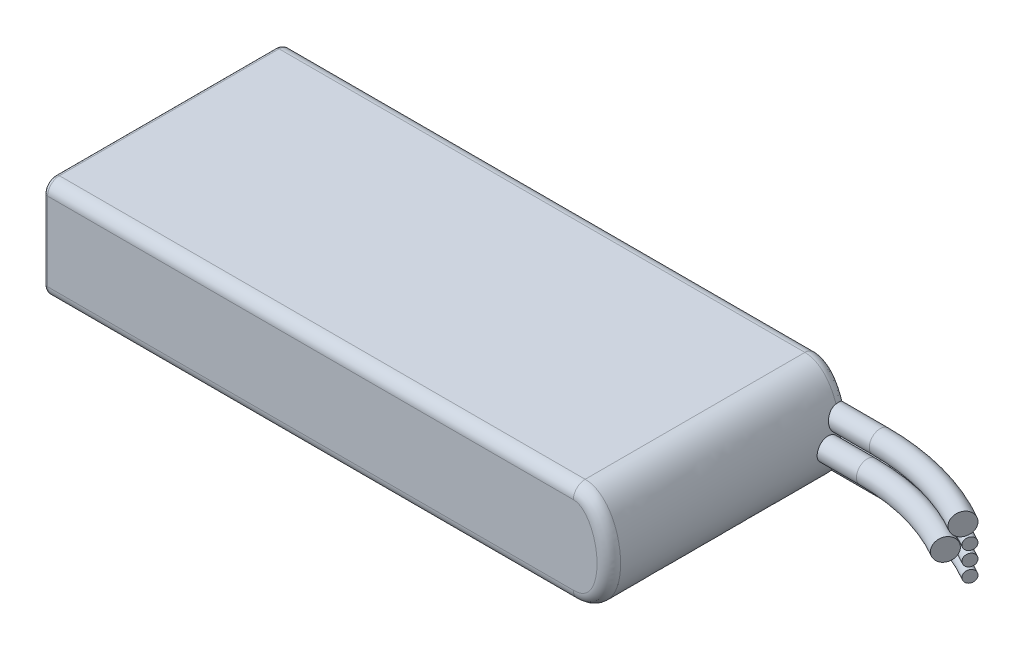
from build123d import *

# Parameters (mm, degrees)
BOSS_EXTRU_1_DEPTH = 15.5
CONG_1_R           = 1.5
CONG_2_R           = 0.5
BOSS_EXTRU_2_START = 2
ESQUISSE2_R        = 0.75
ESQUISSE2_R_2      = 1.4
BOSS_EXTRU_2_DEPTH = 75
ESQUISSE3_R        = 1.4
ESQUISSE3_R_2      = 0.75
R_VOLUTION1_ANGLE  = 30


with BuildPart() as part:
    # Esquisse1 → Boss.-Extru.1 (new, symmetric)
    with BuildSketch(Plane.XY):
        with BuildLine():
            Line((0, 0), (67.5, 0))
            add(Edge.make_bspline(
                [(67.5, 0), (72.819861551, 0), (74.180138449, -13), (67.5, -13)],
                knots=[0, 0, 0, 0, 1, 1, 1, 1], degree=3))
            Line((67.5, -13), (0, -13))
            Line((0, -13), (0, 0))
        make_face()
    extrude(amount=BOSS_EXTRU_1_DEPTH, both=True)

    # Congé1
    cong_1_edges = [part.edges().sort_by_distance(p)[0] for p in [
        (72.006450276, -6.641402384, 15.5),
        (33.75, 0, 15.5),
        (33.75, 0, -15.5),
        (72.006450276, -6.641402384, -15.5),
        (33.75, -13, -15.5),
        (33.75, -13, 15.5),
    ]]
    fillet(cong_1_edges, radius=CONG_1_R)

    # Congé2
    cong_2_edges = [part.edges().sort_by_distance(p)[0] for p in [
        (0, -13, 0),
        (0, -6.5, -15.5),
        (0, -6.5, 15.5),
        (0, 0, 0),
        (0, -0.439339828, 15.060660172),
        (0, -0.439339828, -15.060660172),
        (0, -12.560660172, 15.060660172),
        (0, -12.560660172, -15.060660172),
    ]]
    fillet(cong_2_edges, radius=CONG_2_R)

    # Esquisse2 → Boss.-Extru.2 (add)
    with BuildSketch(Plane(origin=(0, 0, 0), x_dir=(0, 0, -1), z_dir=(1, 0, 0)).offset(BOSS_EXTRU_2_START)):
        with Locations((14.75, -11)):
            Circle(ESQUISSE2_R)
        with Locations((14.75, -9.2)):
            Circle(ESQUISSE2_R)
        with Locations((14.75, -7.4)):
            Circle(ESQUISSE2_R)
        with Locations((14.1, -5.1)):
            Circle(ESQUISSE2_R_2)
        with Locations(Location((12.459782871, -7.611909188, 0), (0, 0, 180))):
            Circle(ESQUISSE2_R_2)
    extrude(amount=BOSS_EXTRU_2_DEPTH)

    # Esquisse3 → Révolution1 (revolve)
    with BuildSketch(Plane(origin=(77, 0, 0), x_dir=(0, 0, -1), z_dir=(1, 0, 0))):
        with Locations(Location((12.459782871, -7.611909188, 0), (0, 0, 180))):
            Circle(ESQUISSE3_R)
        with Locations((14.1, -5.1)):
            Circle(ESQUISSE3_R)
        with Locations((14.75, -7.4)):
            Circle(ESQUISSE3_R_2)
        with Locations((14.75, -9.2)):
            Circle(ESQUISSE3_R_2)
        with Locations((14.75, -11)):
            Circle(ESQUISSE3_R_2)
    revolve(axis=Axis((77, 3.39340925, 14.706419155), (0, -1, 0)), revolution_arc=R_VOLUTION1_ANGLE)


solid = part.part
